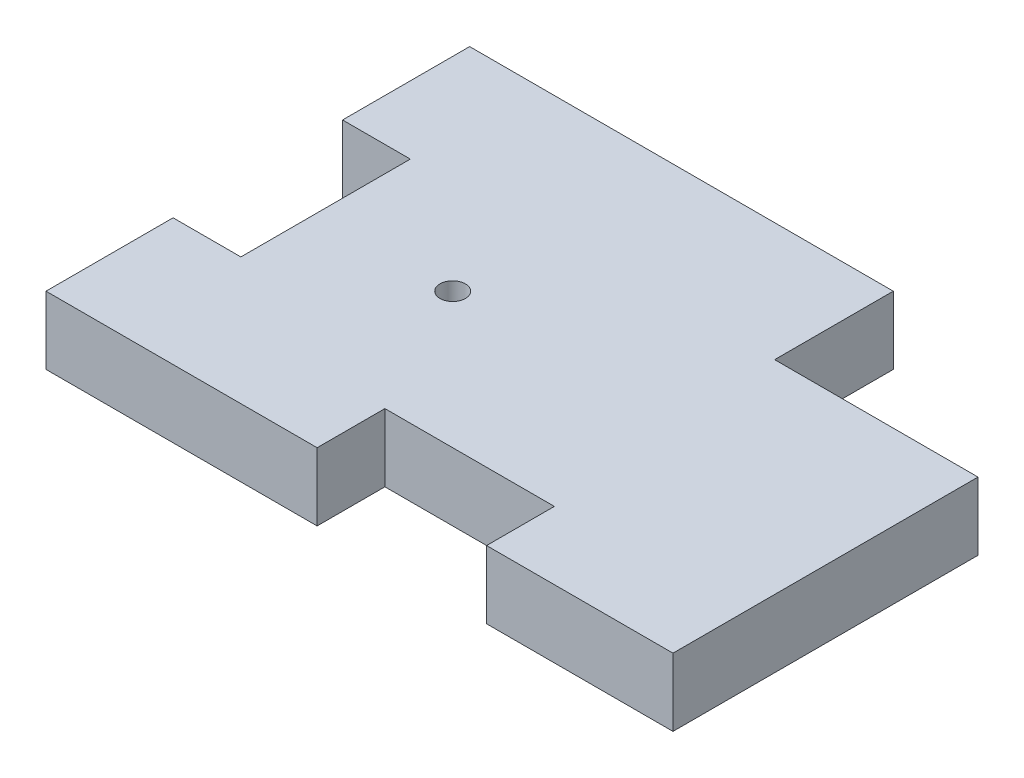
from build123d import *

# Parameters (mm, degrees)
SKETCH1_W           = 37
SKETCH1_H           = 25
BOSS_EXTRUDE1_DEPTH = 4
SKETCH2_W           = 12
SKETCH2_H           = 7
CUT_EXTRUDE1_DEPTH  = 45.833023543
SKETCH3_W           = 4
SKETCH3_H           = 10
CUT_EXTRUDE2_DEPTH  = 45.833023543
SKETCH4_W           = 10
SKETCH4_H           = 4
CUT_EXTRUDE3_DEPTH  = 45.833023543
SKETCH5_R           = 0.75
CUT_EXTRUDE4_DEPTH  = 45.833023543


with BuildPart() as part:
    # Sketch1 → Boss-Extrude1 (new body)
    with BuildSketch(Plane(origin=(0, 0, 0), x_dir=(1, 0, 0), z_dir=(0, 1, 0))):
        with Locations((18.5, -12.5)):
            Rectangle(SKETCH1_W, SKETCH1_H)
    extrude(amount=BOSS_EXTRUDE1_DEPTH)

    # Sketch2 → Cut-Extrude1 (cut, through all)
    with BuildSketch(Plane(origin=(0, 4, 0), x_dir=(1, 0, 0), z_dir=(0, 1, 0))):
        with Locations((31, -3.5)):
            Rectangle(SKETCH2_W, SKETCH2_H)
    extrude(amount=-CUT_EXTRUDE1_DEPTH, mode=Mode.SUBTRACT)

    # Sketch3 → Cut-Extrude2 (cut, through all)
    with BuildSketch(Plane.XZ):
        with Locations((2, 12.5)):
            Rectangle(SKETCH3_W, SKETCH3_H)
    extrude(amount=-CUT_EXTRUDE2_DEPTH, mode=Mode.SUBTRACT)

    # Sketch4 → Cut-Extrude3 (cut, through all)
    with BuildSketch(Plane(origin=(0, 0, 0), x_dir=(-1, 0, 0), z_dir=(0, -1, 0))):
        with Locations((-21, -23)):
            Rectangle(SKETCH4_W, SKETCH4_H)
    extrude(amount=-CUT_EXTRUDE3_DEPTH, mode=Mode.SUBTRACT)

    # Sketch5 → Cut-Extrude4 (cut, through all)
    with BuildSketch(Plane(origin=(0, 4, 0), x_dir=(1, 0, 0), z_dir=(0, 1, 0))):
        with Locations(Location((12, -13, 0), (0, 0, 270))):
            Circle(SKETCH5_R)
    extrude(amount=-CUT_EXTRUDE4_DEPTH, mode=Mode.SUBTRACT)


solid = part.part
